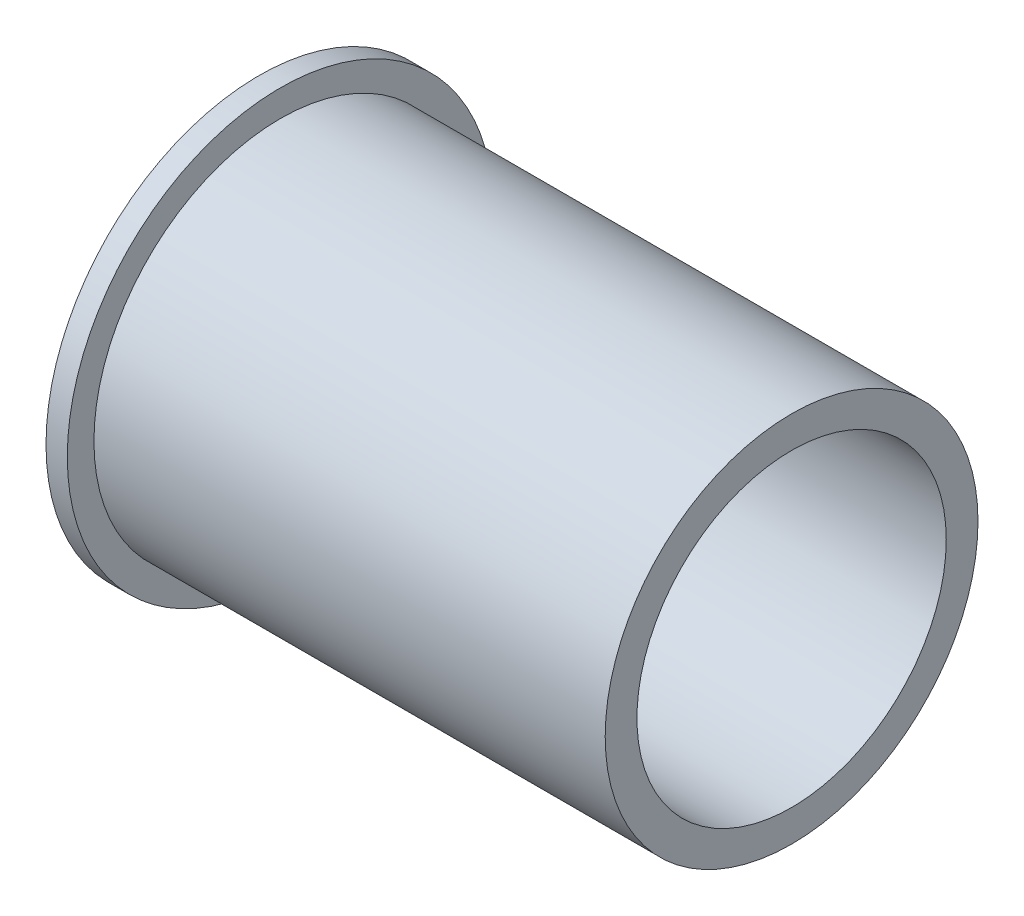
from build123d import *

# Parameters (mm, degrees)
SKETCH1_R           = 11.1125
SKETCH1_R_2         = 9.2202
BOSS_EXTRUDE1_DEPTH = 31.75
SKETCH2_R           = 12.7
SKETCH2_R_2         = 11.1125
BOSS_EXTRUDE2_DEPTH = 1.27


with BuildPart() as part:
    # Sketch1 → Boss-Extrude1 (new body)
    with BuildSketch(Plane(origin=(0, 0, 0), x_dir=(0, 0, -1), z_dir=(1, 0, 0))):
        Circle(SKETCH1_R)
        Circle(SKETCH1_R_2, mode=Mode.SUBTRACT)
    extrude(amount=BOSS_EXTRUDE1_DEPTH)

    # Sketch2 → Boss-Extrude2 (add)
    with BuildSketch(Plane.ZY):
        Circle(SKETCH2_R)
        Circle(SKETCH2_R_2, mode=Mode.SUBTRACT)
    extrude(amount=-BOSS_EXTRUDE2_DEPTH)


solid = part.part
